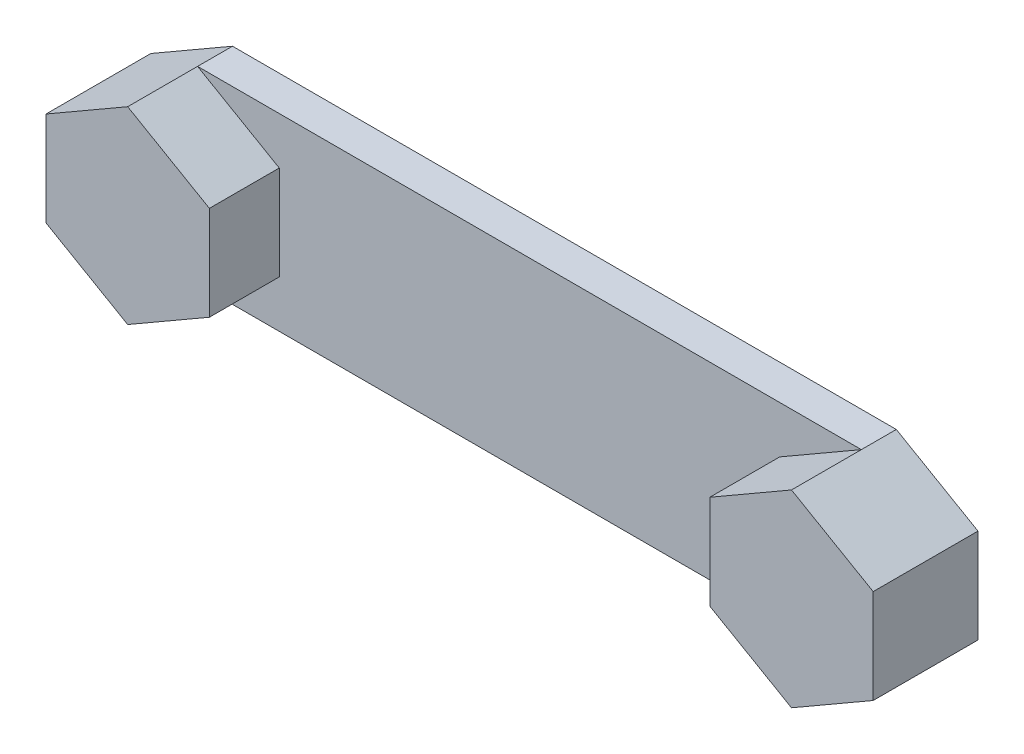
from build123d import *

# Parameters (mm, degrees)
BOSS_EXTRUDE1_DEPTH = 6
BOSS_EXTRUDE2_DEPTH = 3
BOSS_EXTRUDE3_DEPTH = 6


with BuildPart() as part:
    # Sketch1 → Boss-Extrude1 (new body)
    with BuildSketch(Plane.XY):
        Polygon((0, 8.1), (-7.014805771, 4.05), (-7.014805771, -4.05), (0, -8.1), (7.014805771, -4.05), (7.014805771, 4.05), align=None)
    extrude(amount=BOSS_EXTRUDE1_DEPTH)

    # Sketch2 → Boss-Extrude2 (add)
    with BuildSketch(Plane(origin=(0, 0, 0), x_dir=(-1, 0, 0), z_dir=(0, 0, -1))):
        Polygon((0, 8.1), (0, -8.1), (-7.014805771, -4.05), (-7.014805771, 4.05), align=None)
        Polygon((0, 8.1), (0, -8.1), (7.014805771, -4.05), (7.014805771, 4.05), align=None)
        Polygon((0, 8.1), (-28.5, 8.1), (-28.5, -8.1), (0, -8.1), (-7.014805771, -4.05), (-7.014805771, 4.05), align=None)
        Polygon((-28.5, 8.1), (-57, 8.1), (-49.985194229, 4.05), (-49.985194229, -4.05), (-57, -8.1), (-28.5, -8.1), align=None)
        Polygon((-57, 8.1), (-49.985194229, 4.05), (-49.985194229, -4.05), (-57, -8.1), align=None)
        Polygon((-57, 8.1), (-57, -8.1), (-64.014805771, -4.05), (-64.014805771, 4.05), align=None)
    extrude(amount=BOSS_EXTRUDE2_DEPTH)

    # Sketch3 → Boss-Extrude3 (add)
    with BuildSketch(Plane.XY):
        Polygon((64.014805771, -4.05), (64.014805771, 4.05), (57, 8.1), (49.985194229, 4.05), (49.985194229, -4.05), (57, -8.1), align=None)
    extrude(amount=BOSS_EXTRUDE3_DEPTH)


solid = part.part
